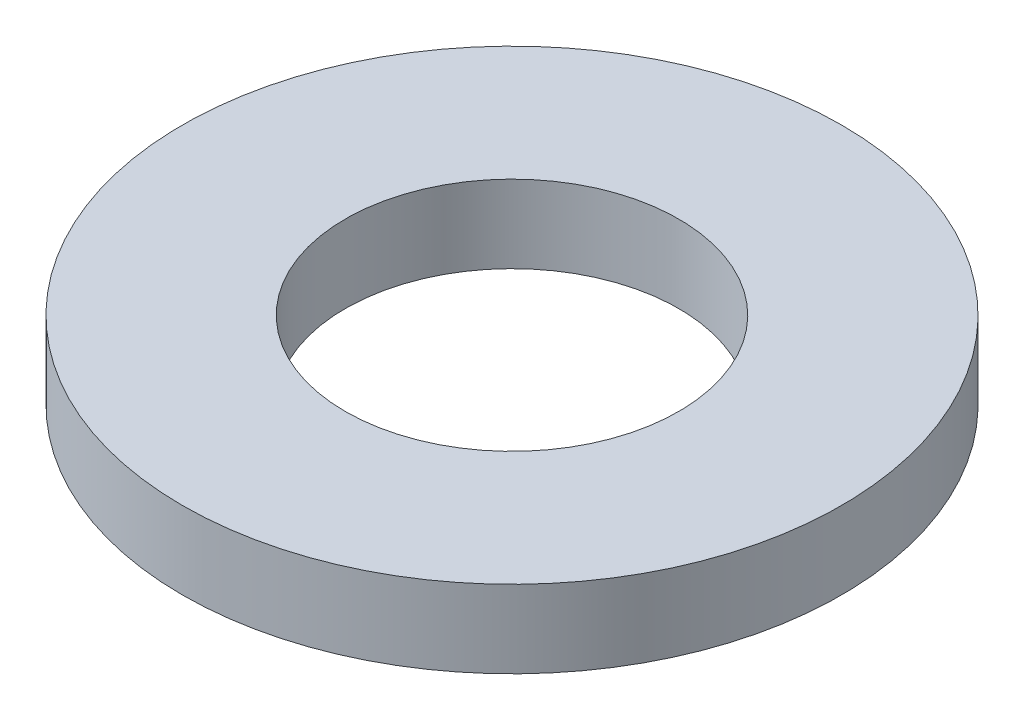
from build123d import *

# Parameters (mm, degrees)
SKETCH_1_R      = 4.25
SKETCH_1_R_2    = 2.15
EXTRUDE_1_DEPTH = 1


with BuildPart() as part:
    # 草图1 → 凸台-拉伸1 (new body)
    with BuildSketch(Plane(origin=(0, 0, 0), x_dir=(1, 0, 0), z_dir=(0, 1, 0))):
        with Locations(Location((0, 0, 0), (0, 0, 270))):
            Circle(SKETCH_1_R)
        with Locations(Location((0, 0, 0), (0, 0, 270))):
            Circle(SKETCH_1_R_2, mode=Mode.SUBTRACT)
    extrude(amount=EXTRUDE_1_DEPTH)


solid = part.part
